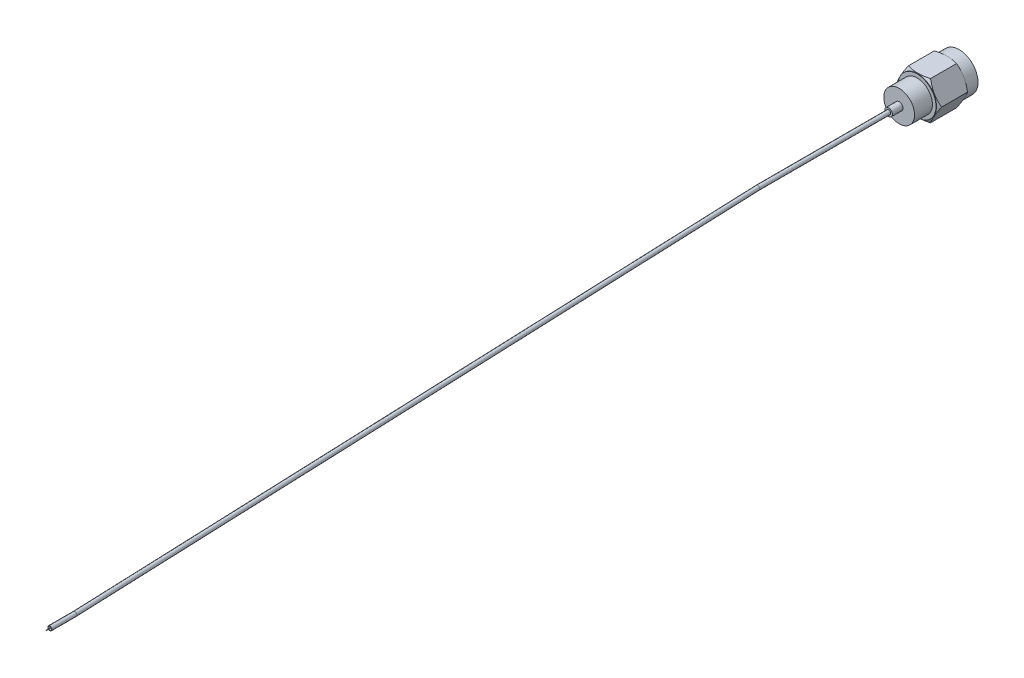
from build123d import *

# Parameters (mm, degrees)
SKETCH1_R                     = 0.4318000000000002
SKETCH1_R_2                   = 0.3429000000000006
CE_00_CONNECTOR_HEX_CUT_REACH = 196.066
SKETCH4_R                     = 5.293177826238989
BE_00_PIN_LNA_END_DEPTH       = 0.762
BE_00_PIN_LNA_END_DEPTH_BACK  = 2.54
SKETCH5_R                     = 0.03555999999999999


with BuildPart() as part:
    # SW-00 Jacket & Layout: sweep along a path in Sketch2
    with BuildLine(Plane(origin=(0, 0, 0), x_dir=(1, 0, 0), z_dir=(0, 1, 0))) as sw_00_jacket_layout_path:
        Line((-0.635, 0), (-0.635, 5.08))
        ThreePointArc((-0.635, 5.08), (-0.6354799554172685, 5.129375532022666), (-0.6369196402854498, 5.178732404160234))
        Line((-0.6369196402854498, 5.178732404160234), (-6.348080359714551, 151.99360009067468))
        ThreePointArc((-6.348080359714551, 151.99360009067468), (-6.349520044582732, 152.04295696281224), (-6.35, 152.0923324948349))
        Line((-6.35, 152.0923324948349), (-6.349999999999999, 181.27980002776076))
    # Sketch1 → SW-00 Jacket & Layout (sweep)
    with BuildSketch(Plane.XY):
        with Locations((-0.635, 0)):
            Circle(SKETCH1_R)
        with Locations((-0.635, 0)):
            Circle(SKETCH1_R_2, mode=Mode.SUBTRACT)
    sweep(path=sw_00_jacket_layout_path.line)

    # Sketch3 → BR-00 Connector Body (revolve)
    with BuildSketch(Plane(origin=(0, 0, 0), x_dir=(1, 0, 0), z_dir=(0, 1, 0)), mode=Mode.PRIVATE) as br_00_connector_body_sk:
        Polygon((-6.349999999999998, 179.09539999999998), (-5.562599999999998, 179.09539999999998), (-5.562599999999998, 181.2798), (-3.174999999999998, 181.2798), (-3.174999999999998, 184.98819999999998), (-2.4383999999999992, 184.98819999999998), (-2.4383999999999992, 185.08979999999997), (-1.4223999999999994, 185.67638787349662), (-1.4223999999999994, 190.65001212650333), (-2.4383999999999997, 191.23659999999998), (-2.4384, 193.67499999999998), (-3.8099999999999996, 193.67499999999998), (-3.8099999999999987, 187.325), (-6.349999999999999, 187.325), align=None)
    revolve(br_00_connector_body_sk.sketch.rotate(Axis((-6.349999999999999, 0, -187.325), (1.2e-16, 0, 1)), 180), axis=Axis((-6.349999999999999, 0, -187.325), (1.2e-16, 0, 1)))

    # CE-00 Connector Hex Cut: up to this cone (the profile starts inside it)
    ce_00_connector_hex_cut_end = Plane(origin=(-6.35, 0, -193.675), z_dir=(-1.2e-16, 0, -1)).offset(-10.843562312962199) * Cone(1.732050805e-06, 391.7745915726082, 226.1911649061025, align=(Align.CENTER, Align.CENTER, Align.MIN), mode=Mode.PRIVATE)
    # Sketch4 → CE-00 Connector Hex Cut (cut, up to the surface)
    with BuildSketch(Plane(origin=(-2.295e-14, 0, -193.67499999999998), x_dir=(-1, 0, 0), z_dir=(0, 0, -1)), mode=Mode.PRIVATE) as ce_00_connector_hex_cut_sk1:
        with Locations((6.349999999999954, 0)):
            Circle(SKETCH4_R)
        Polygon((10.925385413273895, -2.6e-15), (8.637692706636924, 3.9623999999999953), (4.062307293362984, 3.962399999999996), (1.7746145867260137, -3.6e-16), (4.062307293362983, -3.962399999999996), (8.637692706636926, -3.962399999999997), align=None, mode=Mode.SUBTRACT)
    ce_00_connector_hex_cut_tool1 = extrude(ce_00_connector_hex_cut_sk1.sketch, amount=-CE_00_CONNECTOR_HEX_CUT_REACH, mode=Mode.PRIVATE) & ce_00_connector_hex_cut_end
    add(ce_00_connector_hex_cut_tool1.solids().sort_by_distance((-1.206536, 0, -193.675))[0], mode=Mode.SUBTRACT)


with BuildPart() as body_2:
    # Sketch5 → BE-00 Pin LNA End (new, two sides: drawn at the far end of the back side and taken through both)
    with BuildSketch(Plane.XY.offset(-BE_00_PIN_LNA_END_DEPTH_BACK)):
        with Locations((-0.635, 0)):
            Circle(SKETCH5_R)
    extrude(amount=BE_00_PIN_LNA_END_DEPTH + BE_00_PIN_LNA_END_DEPTH_BACK)


solid = Compound([part.part, body_2.part])
